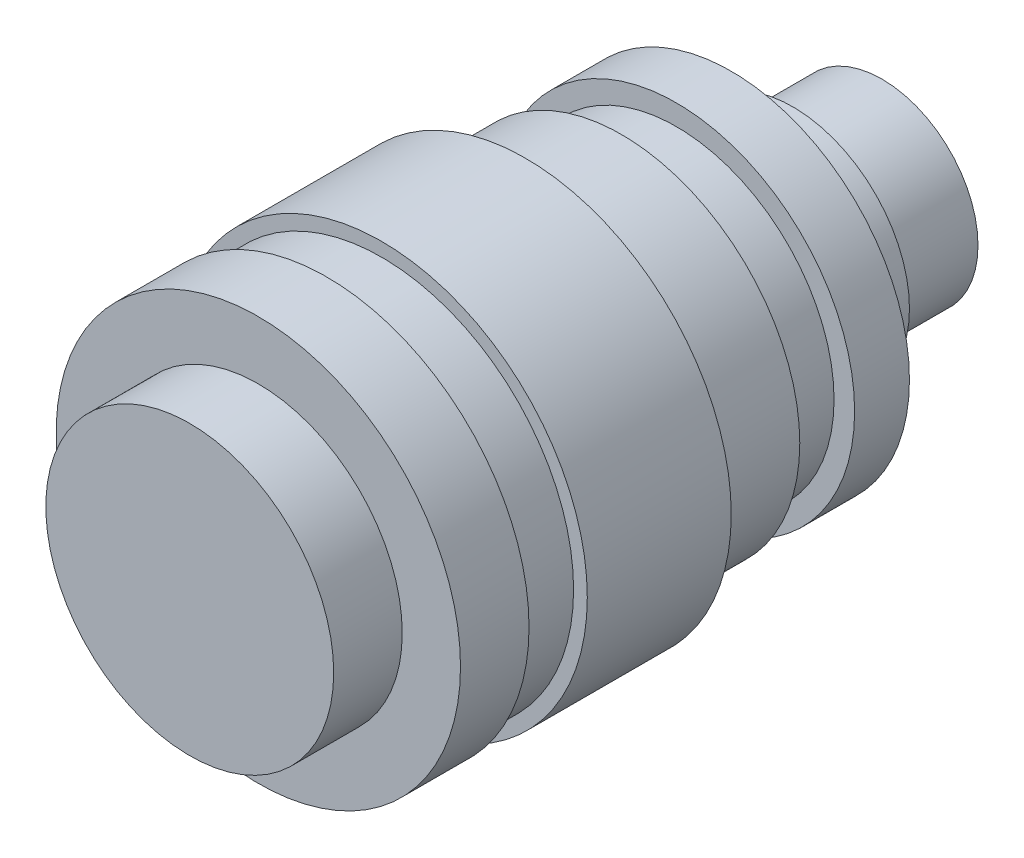
from build123d import *

# Parameters (mm, degrees)
SKETCH1_W   = 5
SKETCH1_H   = 10.5
SKETCH1_H_2 = 14.75
SKETCH1_W_2 = 4
SKETCH1_H_3 = 14
SKETCH1_H_4 = 11.5
SKETCH1_W_3 = 6.5
SKETCH1_H_5 = 7


with BuildPart() as part:
    # Sketch1 → Revolve1 (revolve)
    with BuildSketch(Plane(origin=(0, 0, 0), x_dir=(0, 0, -1), z_dir=(1, 0, 0)), mode=Mode.PRIVATE) as revolve1_sk:
        with Locations((-2.5, 5.25)):
            Rectangle(SKETCH1_W, SKETCH1_H)
        with Locations((2.5, 7.375)):
            Rectangle(SKETCH1_W, SKETCH1_H_2)
        with Locations((7, 7)):
            Rectangle(SKETCH1_W_2, SKETCH1_H_3)
        Polygon((9, 14), (9, 0), (19.5, 0), (19.5, 13), (19.5, 15), (9, 15), align=None)
        Polygon((19.5, 13), (19.5, 0), (26.5, 0), (26.5, 11.5), (26.5, 13), align=None)
        with Locations((28.5, 5.75)):
            Rectangle(SKETCH1_W_2, SKETCH1_H_4)
        Polygon((30.5, 11.5), (30.5, 0), (34.5, 0), (34.5, 8.5), (34.5, 13), (30.5, 13), align=None)
        Polygon((34.5, 8.5), (34.5, 0), (39, 0), (39, 7), (39, 8.5), align=None)
        with Locations((42.25, 3.5)):
            Rectangle(SKETCH1_W_3, SKETCH1_H_5)
    revolve(revolve1_sk.sketch.rotate(Axis((0, 0, -9), (0, 0, -1)), 90), axis=Axis((0, 0, -9), (0, 0, -1)))


solid = part.part
